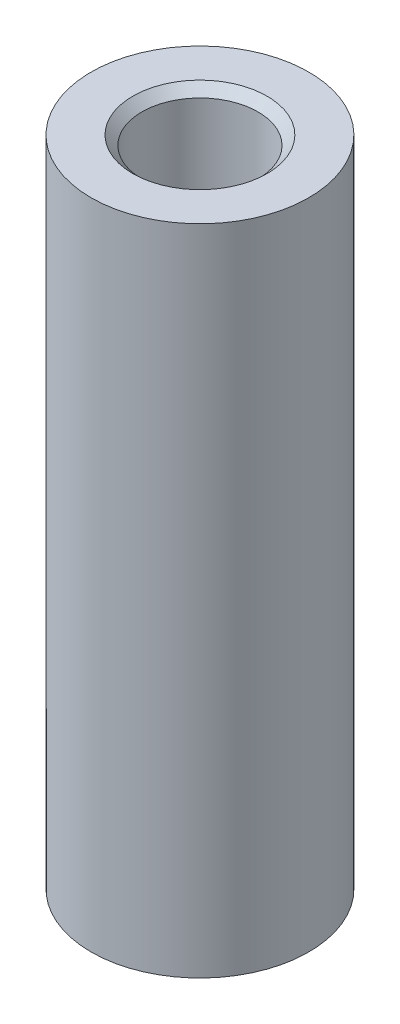
from build123d import *

# Parameters (mm, degrees)
SKETCH1_R            = 3
BOSS_EXTRUDE1_DEPTH  = 18
M3_CLEARANCE_HOLE1_D = 3.2
CHAMFER1_SIZE        = 0.25


with BuildPart() as part:
    # Sketch1 → Boss-Extrude1 (new body)
    with BuildSketch(Plane(origin=(0, 0, 0), x_dir=(1, 0, 0), z_dir=(0, 1, 0))):
        with Locations(Location((0, 0, 0), (0, 0, 270))):
            Circle(SKETCH1_R)
    extrude(amount=BOSS_EXTRUDE1_DEPTH)

    # M3 Clearance Hole1 (through all)
    with Locations(Plane(origin=(0, 18, 0), x_dir=(1, 0, 0), z_dir=(0, 1, 0))):
        with Locations((0, 0)):
            Hole(M3_CLEARANCE_HOLE1_D / 2)

    # Chamfer1
    chamfer1_edges = [part.edges().sort_by_distance(p)[0] for p in [
        (1.6, 18, 0),
        (1.6, 0, 0),
    ]]
    chamfer(chamfer1_edges, length=CHAMFER1_SIZE)


solid = part.part
